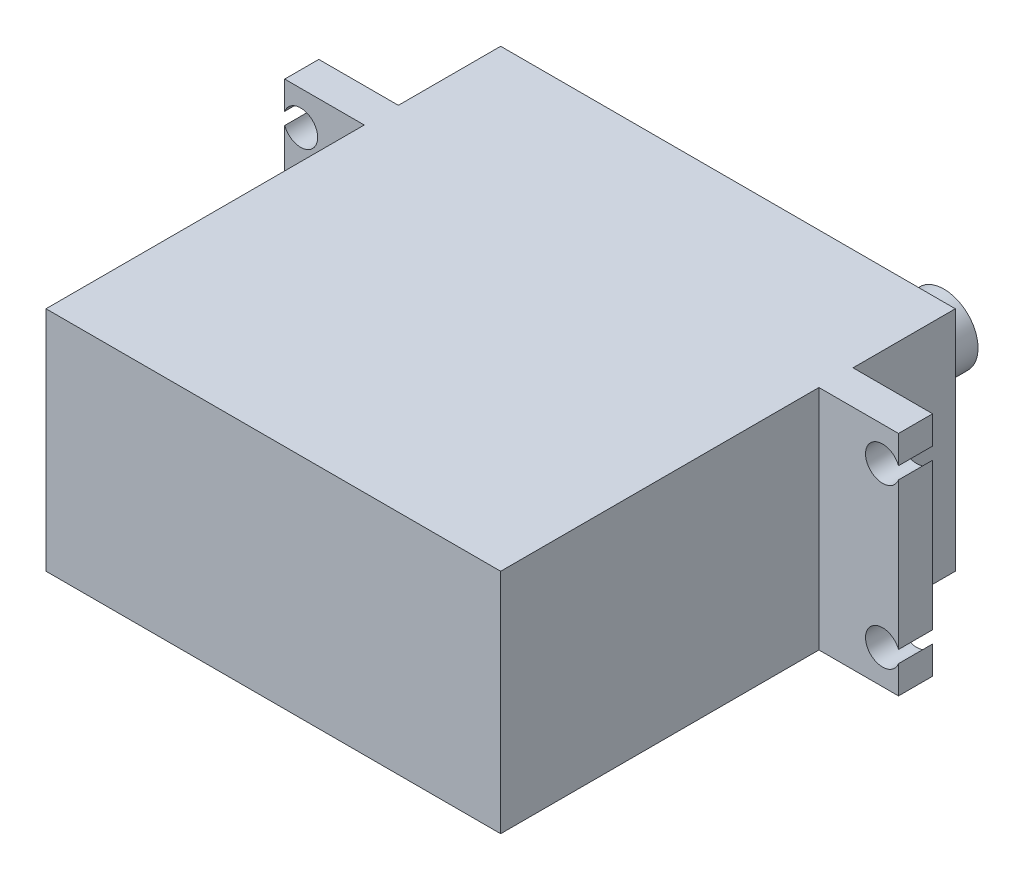
from build123d import *

# Parameters (mm, degrees)
ESQUISSE1_W             = 40
ESQUISSE1_H             = 20
BOSS_EXTRU_1_DEPTH      = 40
ESQUISSE3_W             = 3
ESQUISSE3_H             = 20
BOSS_EXTRU_2_DEPTH      = 7
ESQUISSE4_W             = 3
ESQUISSE4_H             = 20
BOSS_EXTRU_3_DEPTH      = 7
ESQUISSE5_R             = 1.5
ENL_V_MAT_EXTRU_3_DEPTH = 7
ESQUISSE6_R             = 3
BOSS_EXTRU_4_DEPTH      = 8


with BuildPart() as part:
    # Esquisse1 → Boss.-Extru.1 (new body)
    with BuildSketch(Plane.XY):
        with Locations((20, 10)):
            Rectangle(ESQUISSE1_W, ESQUISSE1_H)
    extrude(amount=BOSS_EXTRU_1_DEPTH)

    # Esquisse3 → Boss.-Extru.2 (add)
    with BuildSketch(Plane(origin=(40, 0, 0), x_dir=(0, 0, -1), z_dir=(1, 0, 0))):
        with Locations((-10.5, 10)):
            Rectangle(ESQUISSE3_W, ESQUISSE3_H)
    extrude(amount=BOSS_EXTRU_2_DEPTH)

    # Esquisse4 → Boss.-Extru.3 (add)
    with BuildSketch(Plane.ZY):
        with Locations((10.5, 10)):
            Rectangle(ESQUISSE4_W, ESQUISSE4_H)
    extrude(amount=BOSS_EXTRU_3_DEPTH)

    # Esquisse5 → Enlèv. mat.-Extru.3 (cut)
    with BuildSketch(Plane(origin=(0, 0, 9), x_dir=(-1, 0, 0), z_dir=(0, 0, -1))):
        with Locations((-45.6, 17)):
            Circle(ESQUISSE5_R)
        with Locations((-45.6, 3)):
            Circle(ESQUISSE5_R)
        with Locations((5.6, 17)):
            Circle(ESQUISSE5_R)
        with Locations((5.6, 3)):
            Circle(ESQUISSE5_R)
    extrude(amount=-ENL_V_MAT_EXTRU_3_DEPTH, mode=Mode.SUBTRACT)

    # Esquisse6 → Boss.-Extru.4 (add)
    with BuildSketch(Plane(origin=(0, 0, 0), x_dir=(-1, 0, 0), z_dir=(0, 0, -1))):
        with Locations((-31, 10)):
            Circle(ESQUISSE6_R)
    extrude(amount=BOSS_EXTRU_4_DEPTH)


solid = part.part
